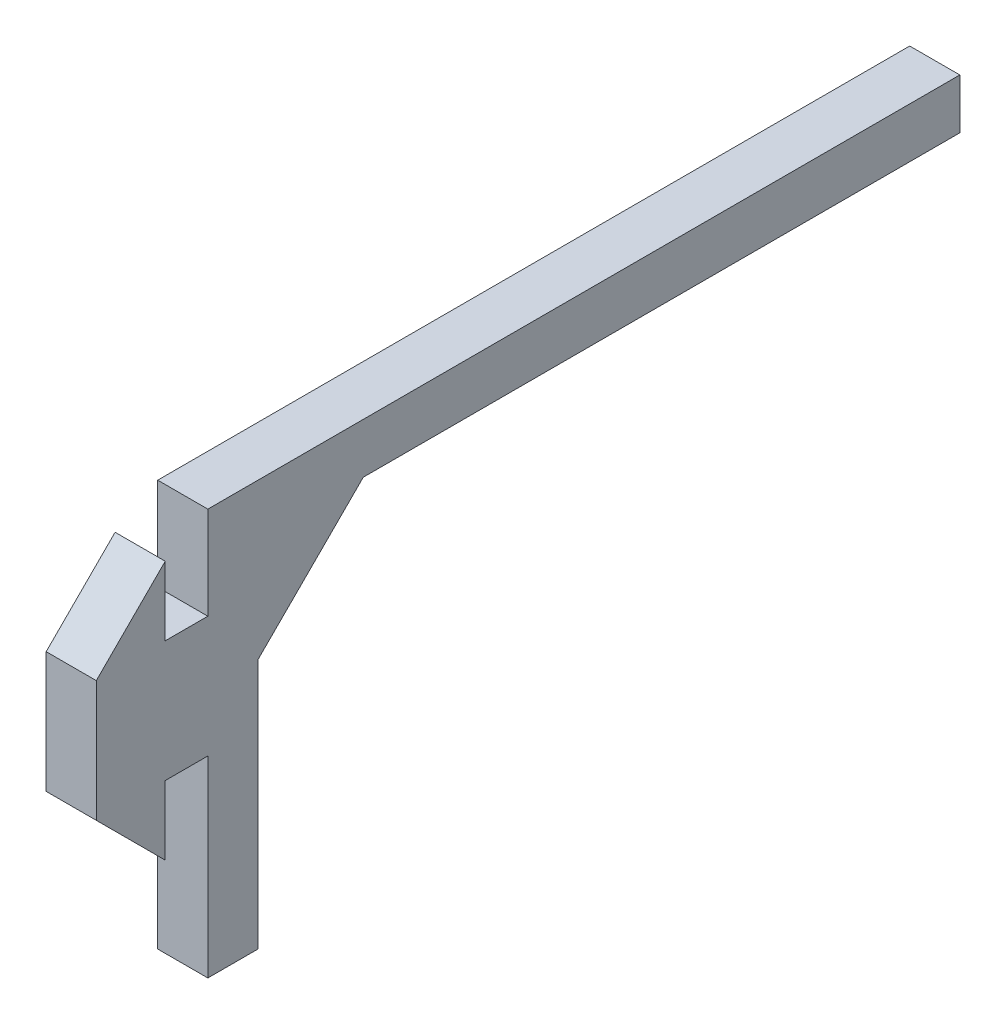
from build123d import *

# Parameters (mm, degrees)
BOSS_EXTRUDE2_DEPTH = 2


with BuildPart() as part:
    # Sketch1 → Boss-Extrude2 (new body)
    with BuildSketch(Plane(origin=(0, 0, 0), x_dir=(0, 0, -1), z_dir=(1, 0, 0))):
        Polygon((0, 7.671680622), (0, 0), (2, 0), (2, 10), (6.2, 14.2), (30, 14.2), (30, 16.2), (0, 16.2), (0, 12.5), (-1.7, 12.5), (-1.7, 15.25), (-4.45, 12.5), (-4.45, 7.671680622), (-1.7, 4.921680622), (-1.7, 7.671680622), align=None)
    extrude(amount=BOSS_EXTRUDE2_DEPTH)


solid = part.part
